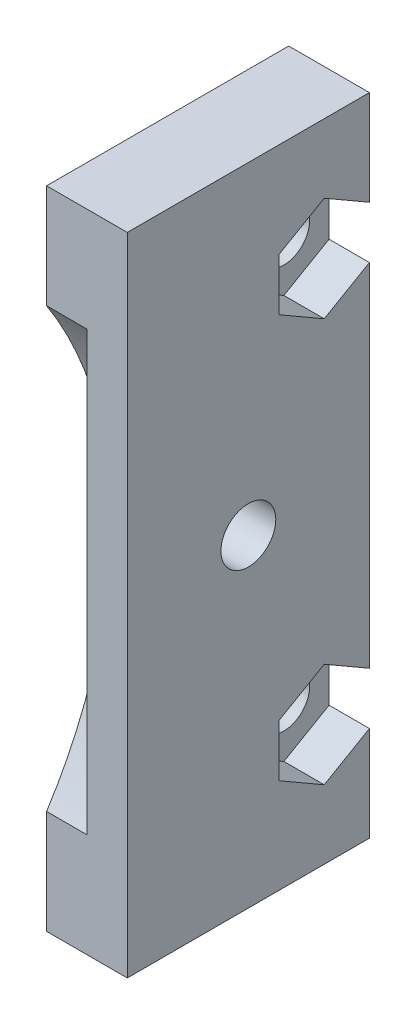
from build123d import *
from build123d.topology import SkipClean

# Parameters (mm, degrees)
SKETCH1_R           = 1.7
BOSS_EXTRUDE1_DEPTH = 2.5
BOSS_EXTRUDE2_START = -2.5
SKETCH1_3_W         = 15
SKETCH1_3_H         = 40
SKETCH1_3_R         = 1.7
SKETCH1_3_R_2       = 1.6
BOSS_EXTRUDE2_DEPTH = 2.5
CUT_EXTRUDE1_DEPTH  = 2.5
BOSS_EXTRUDE3_START = 1
SKETCH2_R           = 1.6
BOSS_EXTRUDE3_DEPTH = 1


with BuildPart() as part:
    # Sketch1 → Boss-Extrude1 (new body)
    with BuildSketch(Plane(origin=(0, 0, 0), x_dir=(0, 0, -1), z_dir=(1, 0, 0))):
        Polygon((15, 40), (0, 40), (0, 0), (15, 0), (15, 5.883419246), (12.2, 4.266838493), (9.4, 5.883419246), (9.4, 9.116580754), (12.2, 10.733161507), (15, 9.116580754), (15, 30.883419246), (12.2, 29.266838493), (9.4, 30.883419246), (9.4, 34.116580754), (12.2, 35.733161507), (15, 34.116580754), align=None)
        with Locations((7.5, 20)):
            Circle(SKETCH1_R, mode=Mode.SUBTRACT)
    extrude(amount=BOSS_EXTRUDE1_DEPTH)

    # Sketch1<3> → Boss-Extrude2 (add)
    with BuildSketch(Plane(origin=(0, 0, 0), x_dir=(0, 0, -1), z_dir=(1, 0, 0)).offset(BOSS_EXTRUDE2_START)):
        with Locations((7.5, 20)):
            Rectangle(SKETCH1_3_W, SKETCH1_3_H)
        with Locations((7.5, 20)):
            Circle(SKETCH1_3_R, mode=Mode.SUBTRACT)
        with Locations((12.2, 32.5)):
            Circle(SKETCH1_3_R_2, mode=Mode.SUBTRACT)
        with Locations((12.2, 7.5)):
            Circle(SKETCH1_3_R_2, mode=Mode.SUBTRACT)
    extrude(amount=BOSS_EXTRUDE2_DEPTH)

    # Sketch3 → Cut-Extrude1 (cut)
    with BuildSketch(Plane.ZY.offset(2.5)):
        with BuildLine():
            ThreePointArc((0, 33.564659966), (-4, 20), (0, 6.435340034))
            Line((0, 6.435340034), (0, 33.564659966))
        make_face()
    extrude(amount=-CUT_EXTRUDE1_DEPTH, mode=Mode.SUBTRACT)

    # Sketch2 → Boss-Extrude3 (add)
    # profile 1 of 2: a face of its own
    with SkipClean():  # the faces are left unmerged after this step: merging them gives an invalid solid
        with BuildSketch(Plane.ZY.offset(2.5).offset(BOSS_EXTRUDE3_START)):
            with BuildLine():
                ThreePointArc((-15, 30.2372583), (-8.6, 32.5), (-15, 34.7627417))
                Line((-15, 34.7627417), (-15, 30.2372583))
            make_face()
            with Locations((-12.2, 32.5)):
                Circle(SKETCH2_R, mode=Mode.SUBTRACT)
        # profile 2 of 2: a face of its own
        with BuildSketch(Plane.ZY.offset(2.5).offset(BOSS_EXTRUDE3_START)):
            with BuildLine():
                ThreePointArc((-15, 5.2372583), (-8.6, 7.5), (-15, 9.7627417))
                Line((-15, 9.7627417), (-15, 5.2372583))
            make_face()
            with Locations((-12.2, 7.5)):
                Circle(SKETCH2_R, mode=Mode.SUBTRACT)
        extrude(amount=-BOSS_EXTRUDE3_DEPTH)


solid = part.part
